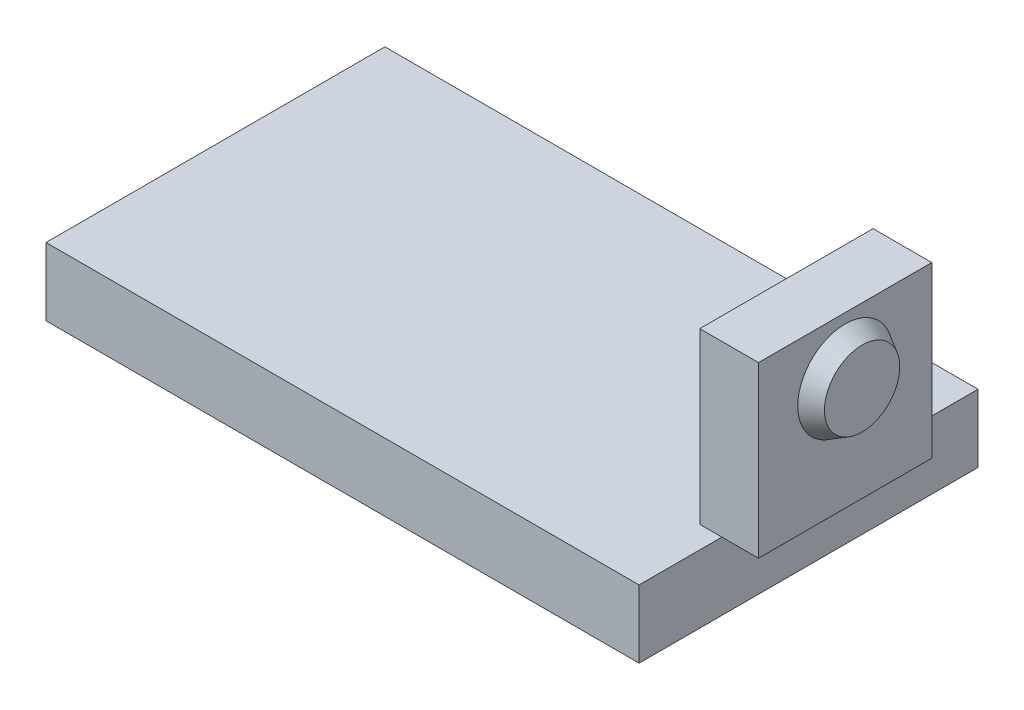
from build123d import *

# Parameters (mm, degrees)
SKETCH1_W           = 35
SKETCH1_H           = 20
BOSS_EXTRUDE1_DEPTH = 4
SKETCH2_W           = 3.466821798
SKETCH2_H           = 10.225967746
BOSS_EXTRUDE2_DEPTH = 10
SKETCH3_R           = 2.80007344
BOSS_EXTRUDE3_DEPTH = 1
BOSS_EXTRUDE3_TAPER = 30


with BuildPart() as part:
    # Sketch1 → Boss-Extrude1 (new body)
    with BuildSketch(Plane(origin=(0, 0, 0), x_dir=(1, 0, 0), z_dir=(0, 1, 0))):
        Rectangle(SKETCH1_W, SKETCH1_H)
    extrude(amount=BOSS_EXTRUDE1_DEPTH)

    # Sketch2 → Boss-Extrude2 (add)
    with BuildSketch(Plane(origin=(0, 4, 0), x_dir=(1, 0, 0), z_dir=(0, 1, 0))):
        with Locations((17.927516635, 0)):
            Rectangle(SKETCH2_W, SKETCH2_H)
    extrude(amount=BOSS_EXTRUDE2_DEPTH)

    # Sketch3 → Boss-Extrude3 (add)
    with BuildSketch(Plane(origin=(19.660927534, 0, 0), x_dir=(0, 0, -1), z_dir=(1, 0, 0))):
        with Locations((0, 10.617493758)):
            Circle(SKETCH3_R)
    extrude(amount=BOSS_EXTRUDE3_DEPTH, taper=BOSS_EXTRUDE3_TAPER)


solid = part.part
